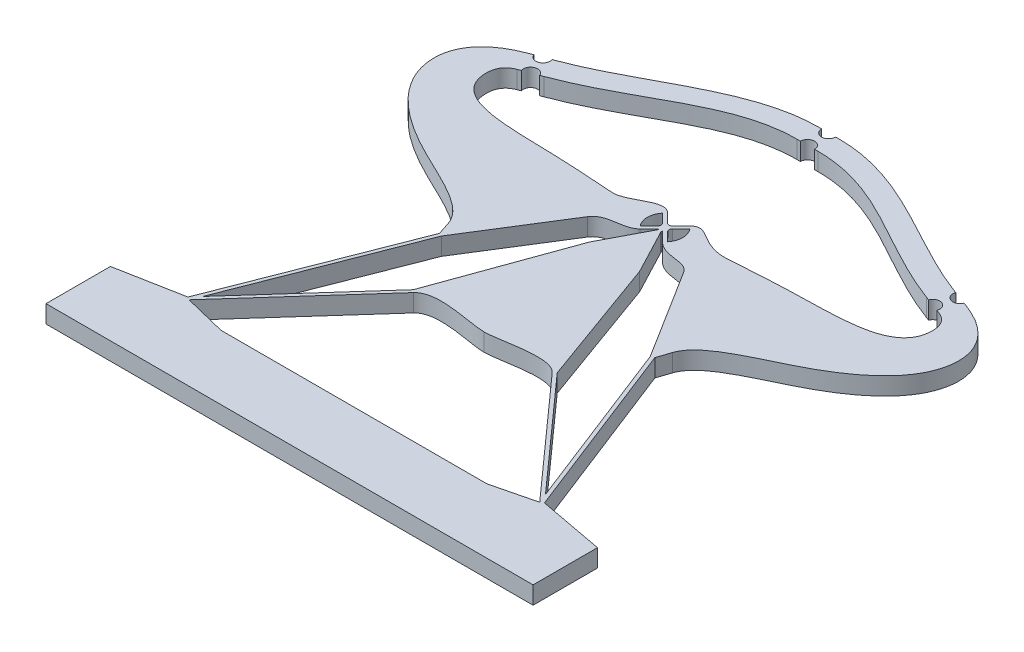
from build123d import *
from build123d.topology import SkipClean

# Parameters (mm, degrees)
BOSS_EXTRUDE1_DEPTH = 10
CUT_EXTRUDE1_START  = -10
SKETCH6_R           = 32
CUT_EXTRUDE1_DEPTH  = 10
BOSS_EXTRUDE3_START = -10
BOSS_EXTRUDE3_DEPTH = 10


with BuildPart() as part:
    # Sketch4 → Boss-Extrude1 (new body)
    with BuildSketch(Plane(origin=(0, 0, 0), x_dir=(1, 0, 0), z_dir=(0, 1, 0))):
        with BuildLine():
            Line((-60.931540979, 102.833144023), (-100.931540979, 0.363636364))
            Line((-100.931540979, 0.363636364), (-137.873440008, -6.581863165))
            Line((-137.873440008, -6.581863165), (-137.873440008, -43.045016767))
            Line((-137.873440008, -43.045016767), (0, -43.045016767))
            Line((0, -43.045016767), (0, -6.581863165))
            Line((0, -6.581863165), (-75.265123248, -6.581863165))
            Line((-75.265123248, -6.581863165), (-99.254644008, -0.666666667))
            Line((-99.254644008, -0.666666667), (-39.254644008, 66.415372658))
            add(Edge.make_bspline(
                [(-39.254644008, 66.415372658), (-32.263304985, 74.231927312), (-8.576970769, 67.082039325), (0, 67.082039325)],
                knots=[0, 0, 0, 0, 1, 1, 1, 1], degree=3))
            Line((0, 67.082039325), (0, 185.898359068))
            add(Edge.make_bspline(
                [(-8.949396824, 172.714099063), (-10.970561894, 176.563352288), (-7.616484748, 181.238960263), (-4.813614966, 185.898359068), (0, 185.898359068)],
                knots=[0, 0, 0, 0, 0.470592774, 1, 1, 1, 1], degree=3))
            ThreePointArc((-8.949396824, 172.714099063), (-8.984162865, 171.72340098), (-9.854808922, 171.249410672))
            Line((-9.854808922, 171.249410672), (-31.928338207, 171.691925306))
            add(Edge.make_bspline(
                [(-119.4438851, 205.142202368), (-125.671665833, 202.815386996), (-131.195665925, 172.228367493), (-78.301604385, 175.640544072), (-35.271953311, 171.758955756), (-31.928338207, 171.691925306)],
                knots=[0, 0, 0, 0, 0.124419451, 0.710010278, 1, 1, 1, 1], degree=3))
            Line((-119.4438851, 205.142202368), (-117.570377314, 205.842179921))
            ThreePointArc((-117.570377314, 205.842179921), (-115.223316728, 210.98915028), (-110.076346168, 208.642090132))
            Line((-110.076346168, 208.642090132), (-108.202838382, 209.342067685))
            add(Edge.make_bspline(
                [(-108.202838382, 209.342067685), (-69.239563588, 223.899475954), (-42.68582532, 250.173769149), (-6, 250.173769149)],
                knots=[0, 0, 0, 0, 1, 1, 1, 1], degree=3))
            Line((-6, 250.173769149), (-4, 250.173769149))
            ThreePointArc((-4, 250.173769149), (-2.828427125, 253.002196274), (0, 254.173769149))
            Line((0, 254.173769149), (0, 258.173769149))
            ThreePointArc((0, 258.173769149), (-2.828427125, 259.345342024), (-4, 262.173769149))
            Line((-4, 262.173769149), (-6, 262.173769149))
            add(Edge.make_bspline(
                [(-112.402703461, 220.583113766), (-76.730376789, 233.910962259), (-44.089424314, 262.173769149), (-6, 262.173769149)],
                knots=[0, 0, 0, 0, 1, 1, 1, 1], degree=3))
            Line((-112.402703461, 220.583113766), (-114.276211247, 219.883136213))
            ThreePointArc((-114.276211247, 219.883136213), (-116.623271833, 214.736165853), (-121.770242393, 217.083226002))
            Line((-121.770242393, 217.083226002), (-123.643750179, 216.383248449))
            add(Edge.make_bspline(
                [(-123.643750179, 216.383248449), (-146.450625439, 207.86217325), (-156.092404914, 174.1495844), (-112.677809008, 138.120350468), (-67.746919643, 123.223591214), (-63.407426979, 110.240571436)],
                knots=[0, 0, 0, 0, 0.283698631, 0.638823971, 1, 1, 1, 1], degree=3))
            Line((-63.407426979, 110.240571436), (-60.931540979, 102.833144023))
        make_face()
        with BuildLine():
            Line((-59.068459021, 102.105871296), (-97.056182656, 4.791287847))
            Line((-97.056182656, 4.791287847), (-40.745355992, 67.748705992))
            Line((-40.745355992, 67.748705992), (-6.453280422, 162.591043343))
            ThreePointArc((-6.453280422, 162.591043343), (-6.944626107, 163.452014183), (-7.935821997, 163.466916409))
            Line((-7.935821997, 163.466916409), (-27.273316425, 152.813380681))
            Line((-27.273316425, 152.813380681), (-59.068459021, 102.105871296))
        make_face(mode=Mode.SUBTRACT)
        with BuildLine():
            Line((-8.989046189, 165.170103317), (-28.265787332, 154.550038176))
            ThreePointArc((-28.265787332, 154.550038176), (-31.069419685, 161.890531357), (-31.999687563, 169.692953814))
            Line((-31.999687563, 169.692953814), (-9.995507461, 169.251829444))
            ThreePointArc((-9.995507461, 169.251829444), (-9.709193652, 167.157479601), (-8.989046189, 165.170103317))
        make_face(mode=Mode.SUBTRACT)
    extrude(amount=BOSS_EXTRUDE1_DEPTH)

    # Mirror1: part across plane


with BuildPart() as part_1:
    add(part.part)
    add(part.part.mirror(Plane(origin=(0, 10, 0), x_dir=(0, 0, 1), z_dir=(1, 0, 0))))

    # Sketch6 → Cut-Extrude1 (cut)
    with SkipClean():  # the faces are left unmerged after this step: merging them gives an invalid solid
        with BuildSketch(Plane(origin=(0, 10, 0), x_dir=(1, 0, 0), z_dir=(0, 1, 0)).offset(CUT_EXTRUDE1_START)):
            with Locations((0, 169.551546985)):
                Circle(SKETCH6_R)
        extrude(amount=CUT_EXTRUDE1_DEPTH, mode=Mode.SUBTRACT)

    # Sketch7 → Boss-Extrude3 (add)
    with BuildSketch(Plane(origin=(0, 10, 0), x_dir=(1, 0, 0), z_dir=(0, 1, 0)).offset(BOSS_EXTRUDE3_START)):
        with BuildLine():
            Line((14.289200309, 140.919069716), (1, 166.232519779))
            Line((1, 166.232519779), (1, 167.040957105))
            ThreePointArc((1, 167.040957105), (1.217522858, 166.895612978), (1.414213562, 166.72311986))
            Line((1.414213562, 166.72311986), (6.363961031, 161.773372392))
            add(Edge.make_bspline(
                [(6.363961031, 161.773372392), (13.42797039, 154.709363033), (23.232750867, 159.257352912), (27.273316425, 152.813380681)],
                knots=[0, 0, 0, 0, 1, 1, 1, 1], degree=3))
            ThreePointArc((27.273316425, 152.813380681), (31.069419685, 161.890531357), (31.928338207, 171.691925306))
            add(Edge.make_bspline(
                [(6.363961031, 177.329721578), (12.503350482, 183.469111029), (17.431423379, 171.401301325), (31.928338207, 171.691925306)],
                knots=[0, 0, 0, 0, 1, 1, 1, 1], degree=3))
            Line((6.363961031, 177.329721578), (1.414213562, 172.379974109))
            ThreePointArc((1.414213562, 172.379974109), (0, 171.794187672), (-1.414213562, 172.379974109))
            Line((-1.414213562, 172.379974109), (-6.363961031, 177.329721578))
            add(Edge.make_bspline(
                [(-31.928338207, 171.691925306), (-23.203871901, 171.517023324), (-12.870439893, 183.83620044), (-6.363961031, 177.329721578)],
                knots=[0, 0, 0, 0, 1, 1, 1, 1], degree=3))
            ThreePointArc((-31.928338207, 171.691925306), (-31.069419685, 161.890531357), (-27.273316425, 152.813380681))
            add(Edge.make_bspline(
                [(-27.273316425, 152.813380681), (-22.704943746, 160.099109933), (-11.725773506, 156.411559916), (-6.363961031, 161.773372392)],
                knots=[0, 0, 0, 0, 1, 1, 1, 1], degree=3))
            Line((-6.363961031, 161.773372392), (-1.414213562, 166.72311986))
            ThreePointArc((-1.414213562, 166.72311986), (-1.217522858, 166.895612978), (-1, 167.040957105))
            Line((-1, 167.040957105), (-1, 166.232519779))
            Line((-1, 166.232519779), (-14.289200309, 140.919069716))
            ThreePointArc((-14.289200309, 140.919069716), (0, 137.551546985), (14.289200309, 140.919069716))
        make_face()
        with BuildLine():
            ThreePointArc((-7.742730421, 163.223030126), (-10, 169.551546985), (-7.742730421, 175.880063843))
            Line((-7.742730421, 175.880063843), (-2.828427125, 170.965760547))
            ThreePointArc((-2.828427125, 170.965760547), (-2.242640687, 169.551546985), (-2.828427125, 168.137333422))
            Line((-2.828427125, 168.137333422), (-7.742730421, 163.223030126))
        make_face(mode=Mode.SUBTRACT)
        with BuildLine():
            Line((2.828427125, 170.965760547), (7.742730421, 175.880063843))
            ThreePointArc((7.742730421, 175.880063843), (10, 169.551546985), (7.742730421, 163.223030126))
            Line((7.742730421, 163.223030126), (2.828427125, 168.137333422))
            ThreePointArc((2.828427125, 168.137333422), (2.242640687, 169.551546985), (2.828427125, 170.965760547))
        make_face(mode=Mode.SUBTRACT)
    extrude(amount=BOSS_EXTRUDE3_DEPTH)


solid = part_1.part
